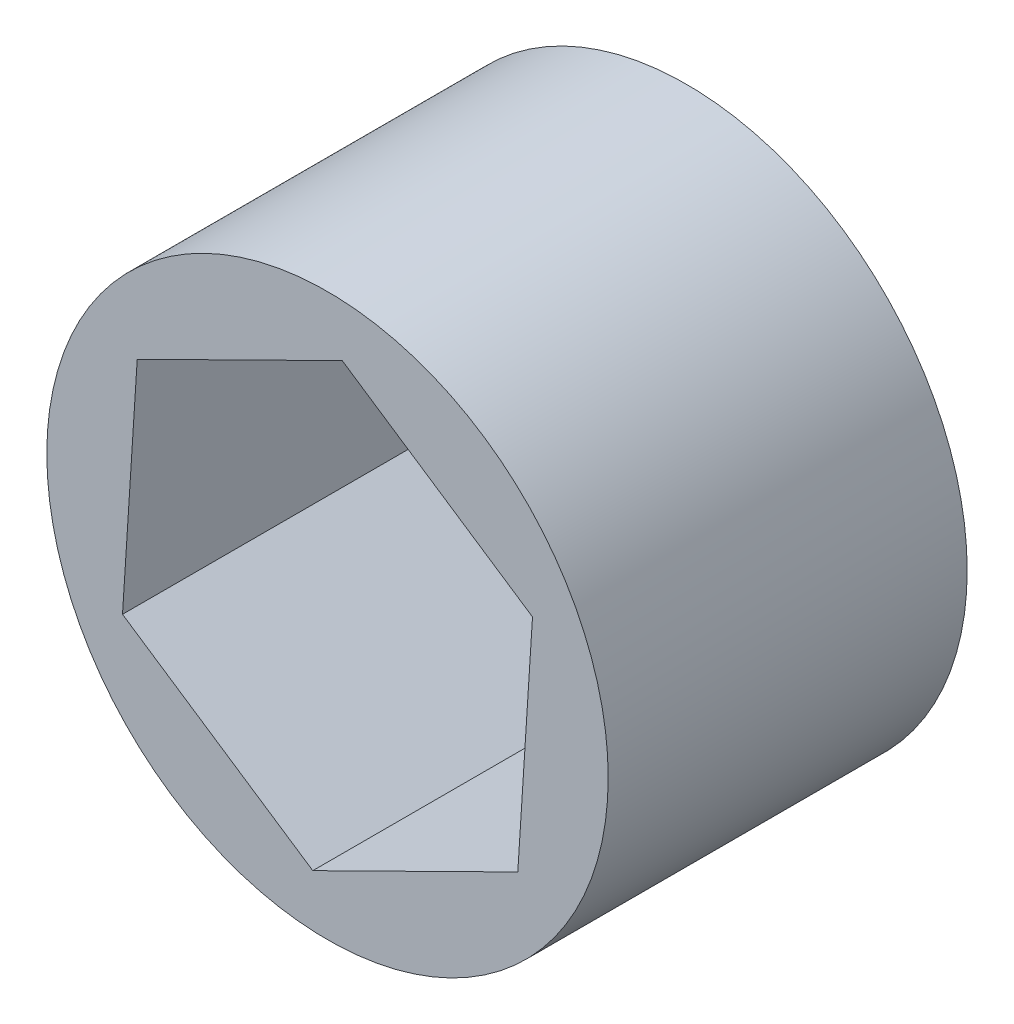
from build123d import *

# Parameters (mm, degrees)
SKETCH1_R           = 9
BOSS_EXTRUDE1_DEPTH = 11.51


with BuildPart() as part:
    # Sketch1 → Boss-Extrude1 (new body)
    with BuildSketch(Plane.XY):
        Circle(SKETCH1_R)
        Polygon((-6.10088266, 4.067255107), (-6.572787576, -3.249891816), (-0.471904916, -7.317146922), (6.10088266, -4.067255107), (6.572787576, 3.249891816), (0.471904916, 7.317146922), align=None, mode=Mode.SUBTRACT)
    extrude(amount=BOSS_EXTRUDE1_DEPTH)


solid = part.part
